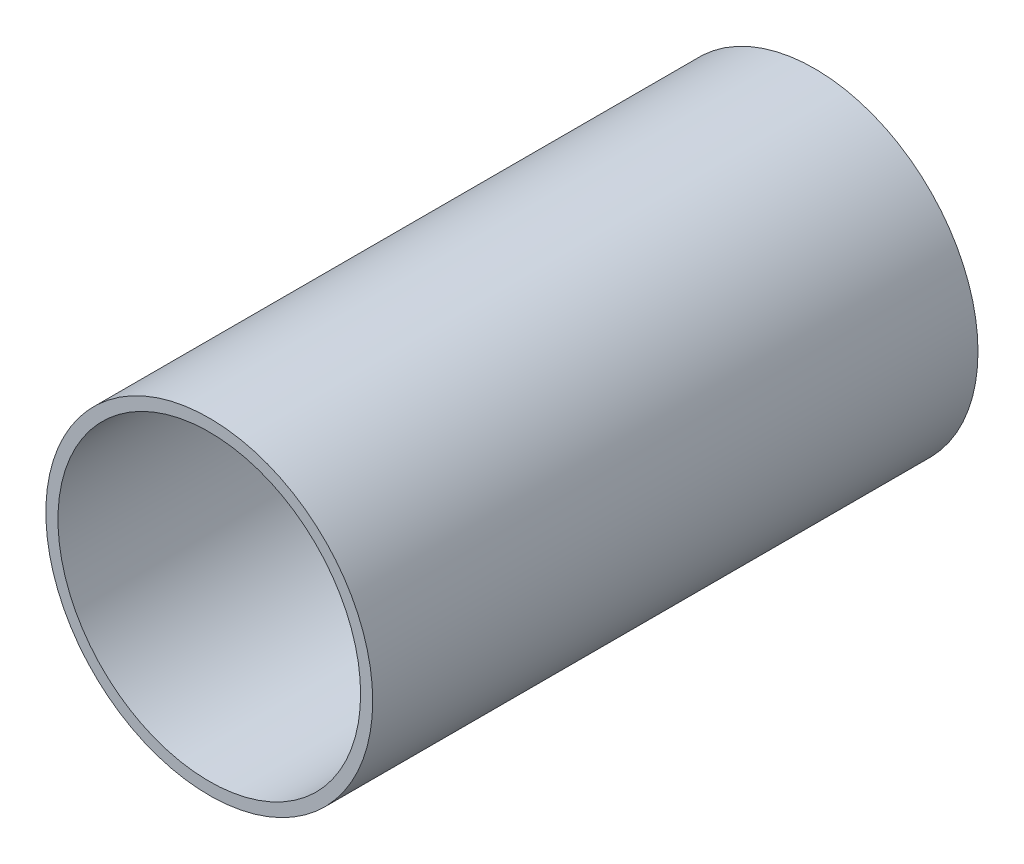
from build123d import *

# Parameters (mm, degrees)
SKETCH3_R           = 13.5
BOSS_EXTRUDE1_DEPTH = 50
SKETCH4_R           = 12.5
CUT_EXTRUDE1_DEPTH  = 100


with BuildPart() as part:
    # Sketch3 → Boss-Extrude1 (new body)
    with BuildSketch(Plane.XY):
        Circle(SKETCH3_R)
    extrude(amount=BOSS_EXTRUDE1_DEPTH)

    # Sketch4 → Cut-Extrude1 (cut)
    with BuildSketch(Plane.XY.offset(50)):
        Circle(SKETCH4_R)
    extrude(amount=-CUT_EXTRUDE1_DEPTH, mode=Mode.SUBTRACT)


solid = part.part
